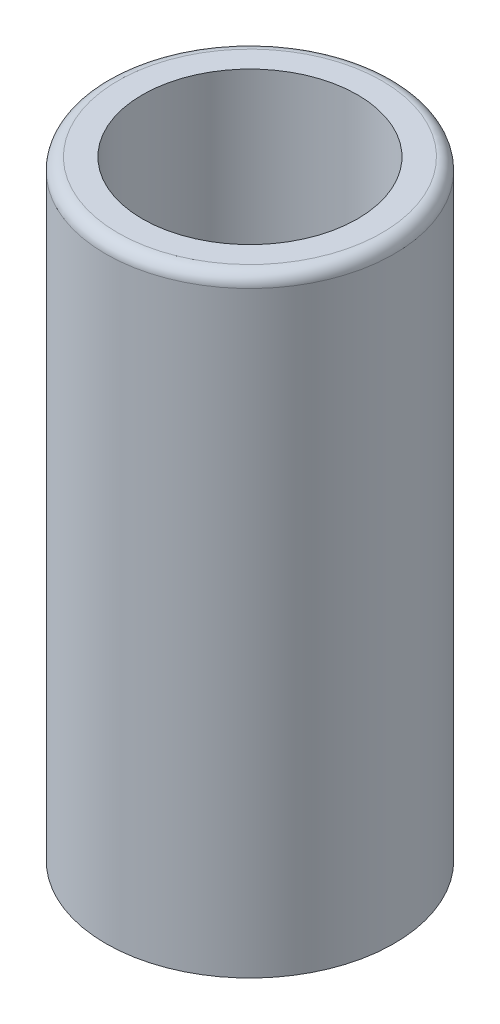
from build123d import *

# Parameters (mm, degrees)
SKETCH1_R            = 11.825
MAIN_STRUCTURE_DEPTH = 50
SKETCH2_R            = 8.825
HOLE_DEPTH           = 15.5
STRUCTURE_FILLET_R   = 1
CUT_EXTRUDE1_REACH   = 54.722
SKETCH3_R            = 0.795


with BuildPart() as part:
    # Sketch1 → Main Structure (new body)
    with BuildSketch(Plane(origin=(0, 0, 0), x_dir=(1, 0, 0), z_dir=(0, 1, 0))):
        with Locations(Location((0, 0, 0), (0, 0, 270))):
            Circle(SKETCH1_R)
    extrude(amount=MAIN_STRUCTURE_DEPTH)

    # Sketch2 → Hole (cut)
    with BuildSketch(Plane(origin=(0, 50, 0), x_dir=(1, 0, 0), z_dir=(0, 1, 0))):
        with Locations(Location((0, 0, 0), (0, 0, 270))):
            Circle(SKETCH2_R)
    extrude(amount=-HOLE_DEPTH, mode=Mode.SUBTRACT)

    # Structure Fillet
    structure_fillet_edges = [part.edges().sort_by_distance(p)[0] for p in [
        (0, 50, -11.825),
    ]]
    fillet(structure_fillet_edges, radius=STRUCTURE_FILLET_R)

    # Sketch3 → Cut-Extrude1 (cut, up to next)
    with BuildSketch(Plane.XZ, mode=Mode.PRIVATE) as cut_extrude1_sk1:
        with Locations(Location((0, 0, 0), (0, 0, 270))):
            Circle(SKETCH3_R)
    cut_extrude1_tool1 = extrude(cut_extrude1_sk1.sketch, amount=-CUT_EXTRUDE1_REACH, mode=Mode.PRIVATE) & part.part
    add(cut_extrude1_tool1.solids().sort_by_distance((0, 0, 0))[0], mode=Mode.SUBTRACT)


solid = part.part
